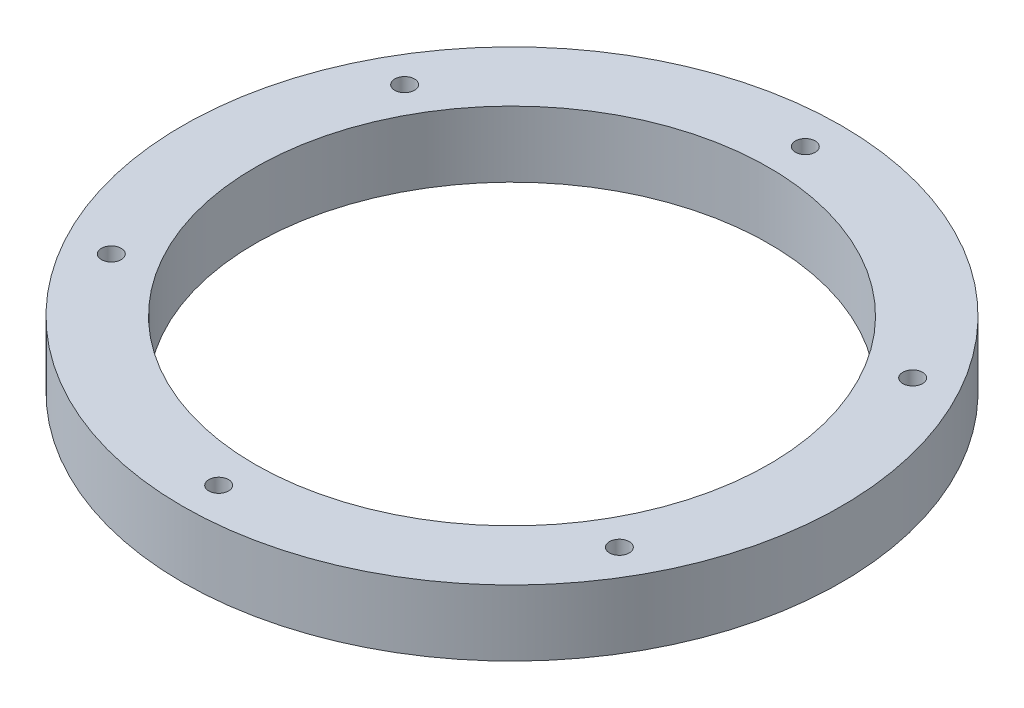
from build123d import *

# Parameters (mm, degrees)
SKETCH_1_R          = 50
SKETCH_1_R_2        = 39
EXTRUDE_1_DEPTH     = 10
SKETCH_2_R          = 1.5
CUT_EXTRUDE_1_DEPTH = 10


with BuildPart() as part:
    # 草图1 → 凸台-拉伸1 (new body)
    with BuildSketch(Plane(origin=(0, 0, 0), x_dir=(1, 0, 0), z_dir=(0, 1, 0))):
        with Locations(Location((0, 0, 0), (0, 0, 270))):
            Circle(SKETCH_1_R)
        with Locations(Location((0, 0, 0), (0, 0, 270))):
            Circle(SKETCH_1_R_2, mode=Mode.SUBTRACT)
    extrude(amount=EXTRUDE_1_DEPTH)

    # 草图2 → 切除-拉伸1 (cut)
    with BuildSketch(Plane(origin=(0, 10, 0), x_dir=(1, 0, 0), z_dir=(0, 1, 0))):
        with Locations(Location((0, 44.5, 0), (0, 0, 270))):
            Circle(SKETCH_2_R)
        with Locations(Location((38.538130468, 22.25, 0), (0, 0, 270))):
            Circle(SKETCH_2_R)
        with Locations(Location((38.538130468, -22.25, 0), (0, 0, 270))):
            Circle(SKETCH_2_R)
        with Locations(Location((0, -44.5, 0), (0, 0, 270))):
            Circle(SKETCH_2_R)
        with Locations(Location((-38.538130468, -22.25, 0), (0, 0, 270))):
            Circle(SKETCH_2_R)
        with Locations(Location((-38.538130468, 22.25, 0), (0, 0, 270))):
            Circle(SKETCH_2_R)
    extrude(amount=-CUT_EXTRUDE_1_DEPTH, mode=Mode.SUBTRACT)


solid = part.part
